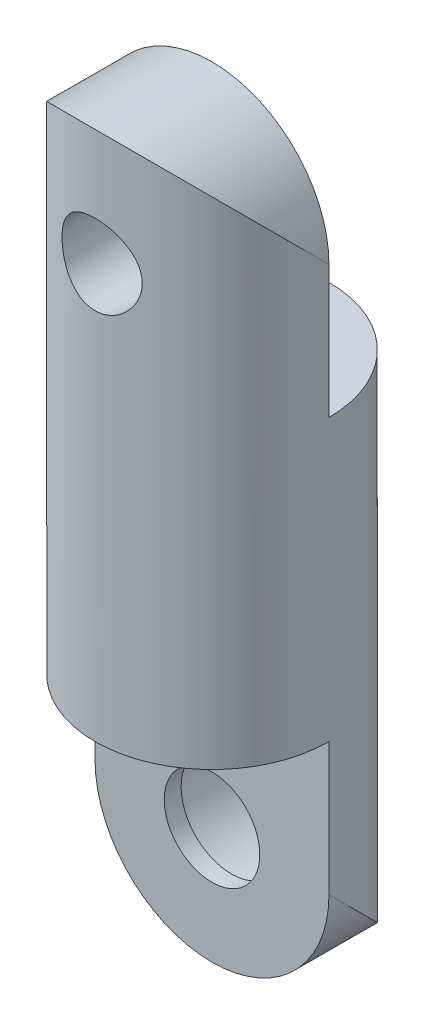
from build123d import *

# Parameters (mm, degrees)
CROQUIS1_R                                           = 9.525
SALIENTE_EXTRUIR1_DEPTH                              = 63.5
CROQUIS2_W                                           = 19.05
CROQUIS2_H                                           = 20.32
CORTAR_EXTRUIR1_DEPTH                                = 15.748
CORTAR_EXTRUIR2_DEPTH                                = 15.748
TALADRO_ROSCADO_5_16_181_D                           = 6.5278
TALADRO_ROSCADO_5_16_181_DEPTH                       = 22.9235
TALADRO_ROSCADO_5_16_181_TIP                         = 1.961148974
CROQUIS6_W                                           = 19.05
CROQUIS6_H                                           = 20.32
CORTAR_EXTRUIR3_DEPTH                                = 19.05
CORTAR_EXTRUIR4_DEPTH                                = 19.05
REFRENTADO_PARA_TORNILLO_CON_CABEZA_HUEC_D           = 8.2042
REFRENTADO_PARA_TORNILLO_CON_CABEZA_HUEC_DEPTH       = 9.398
REFRENTADO_PARA_TORNILLO_CON_CABEZA_HUEC_CBORE_D     = 12.446
REFRENTADO_PARA_TORNILLO_CON_CABEZA_HUEC_CBORE_DEPTH = 7.9375
REFRENTADO_PARA_TORNILLO_CON_CABEZA_HUEC_TIP         = 2.464790345


with BuildPart() as part:
    # Croquis1 → Saliente-Extruir1 (new body)
    with BuildSketch(Plane(origin=(0, 0, 0), x_dir=(1, 0, 0), z_dir=(0, 1, 0))):
        with Locations(Location((0, 0, 0), (0, 0, 270))):
            Circle(CROQUIS1_R)
    extrude(amount=SALIENTE_EXTRUIR1_DEPTH)

    # Croquis2 → Cortar-Extruir1 (cut)
    with BuildSketch(Plane.XY):
        with Locations((0, 53.34)):
            Rectangle(CROQUIS2_W, CROQUIS2_H)
    extrude(amount=-CORTAR_EXTRUIR1_DEPTH, mode=Mode.SUBTRACT)

    # Croquis3 → Cortar-Extruir2 (cut)
    with BuildSketch(Plane(origin=(0, 0, 0), x_dir=(-1, 0, 0), z_dir=(0, 0, -1))):
        with BuildLine():
            Line((-9.525, 63.5), (-9.525, 53.975))
            ThreePointArc((-9.525, 53.975), (-6.735192091, 60.710192091), (0, 63.5))
            Line((0, 63.5), (-9.525, 63.5))
        make_face()
        with BuildLine():
            Line((9.525, 63.5), (0, 63.5))
            ThreePointArc((0, 63.5), (6.735192091, 60.710192091), (9.525, 53.975))
            Line((9.525, 53.975), (9.525, 63.5))
        make_face()
    extrude(amount=-CORTAR_EXTRUIR2_DEPTH, mode=Mode.SUBTRACT)

    # Taladro roscado 5/16-181
    with Locations(Plane(origin=(0, 0, 0), x_dir=(-1, 0, 0), z_dir=(0, 0, -1))):
        with Locations((0, 53.975)):
            Hole(TALADRO_ROSCADO_5_16_181_D / 2, depth=TALADRO_ROSCADO_5_16_181_DEPTH)
            with Locations((0, 0, -(TALADRO_ROSCADO_5_16_181_DEPTH + TALADRO_ROSCADO_5_16_181_TIP / 2))):  # 118° drill point
                Cone(0, TALADRO_ROSCADO_5_16_181_D / 2, TALADRO_ROSCADO_5_16_181_TIP, mode=Mode.SUBTRACT)

    # Croquis6 → Cortar-Extruir3 (cut)
    with BuildSketch(Plane.XY):
        with Locations((0, 10.16)):
            Rectangle(CROQUIS6_W, CROQUIS6_H)
    extrude(amount=CORTAR_EXTRUIR3_DEPTH, mode=Mode.SUBTRACT)

    # Croquis7 → Cortar-Extruir4 (cut)
    with BuildSketch(Plane.XY):
        with BuildLine():
            ThreePointArc((-3.4e-08, 0), (-6.735192103, 2.789807921), (-9.525, 9.525))
            Line((-9.525, 9.525), (-9.525, 0))
            Line((-9.525, 0), (-3.4e-08, 0))
        make_face()
        with BuildLine():
            ThreePointArc((9.525, 9.525), (6.735192079, 2.789807897), (-3.4e-08, 0))
            Line((-3.4e-08, 0), (9.525, 0))
            Line((9.525, 0), (9.525, 9.525))
        make_face()
    extrude(amount=-CORTAR_EXTRUIR4_DEPTH, mode=Mode.SUBTRACT)

    # Refrentado para tornillo con cabeza hueca de 5/161
    with Locations(Plane(origin=(0, 0, -9.525), x_dir=(-1, 0, 0), z_dir=(0, 0, -1))):
        with Locations((0, 9.525)):
            CounterBoreHole(REFRENTADO_PARA_TORNILLO_CON_CABEZA_HUEC_D / 2, REFRENTADO_PARA_TORNILLO_CON_CABEZA_HUEC_CBORE_D / 2, REFRENTADO_PARA_TORNILLO_CON_CABEZA_HUEC_CBORE_DEPTH, depth=REFRENTADO_PARA_TORNILLO_CON_CABEZA_HUEC_DEPTH)
            with Locations((0, 0, -(REFRENTADO_PARA_TORNILLO_CON_CABEZA_HUEC_DEPTH + REFRENTADO_PARA_TORNILLO_CON_CABEZA_HUEC_TIP / 2))):  # 118° drill point
                Cone(0, REFRENTADO_PARA_TORNILLO_CON_CABEZA_HUEC_D / 2, REFRENTADO_PARA_TORNILLO_CON_CABEZA_HUEC_TIP, mode=Mode.SUBTRACT)


solid = part.part
